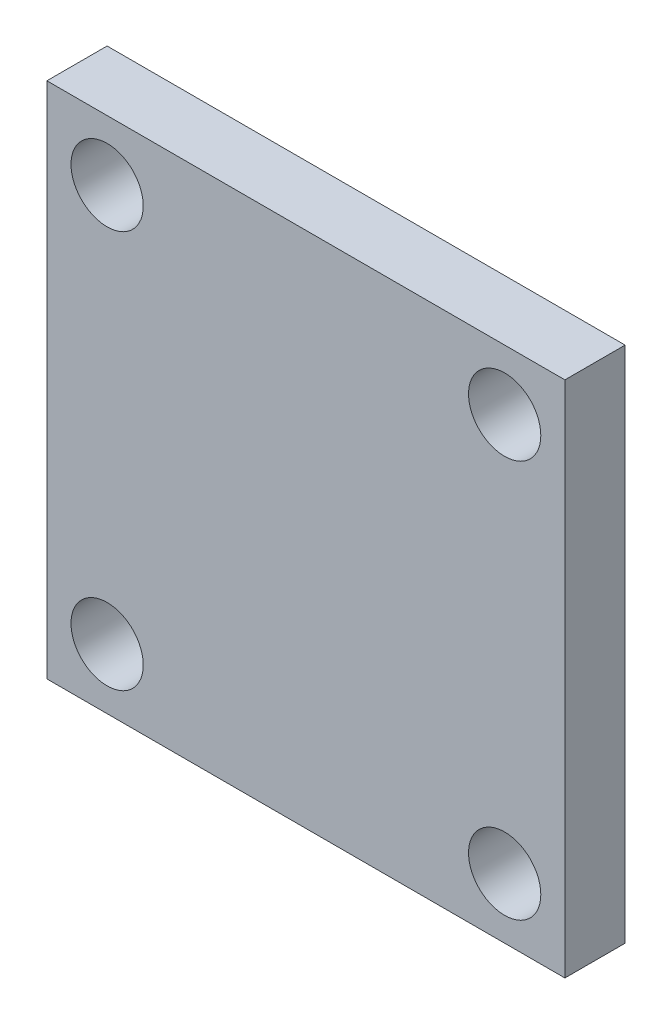
from build123d import *

# Parameters (mm, degrees)
SKETCH_1_W      = 43
SKETCH_1_H      = 43
SKETCH_1_R      = 3
EXTRUDE_1_DEPTH = 5


with BuildPart() as part:
    # 草图1 → 凸台-拉伸1 (new body)
    with BuildSketch(Plane.XY):
        Rectangle(SKETCH_1_W, SKETCH_1_H)
        with Locations((-16.5, -16.5)):
            Circle(SKETCH_1_R, mode=Mode.SUBTRACT)
        with Locations((-16.5, 16.5)):
            Circle(SKETCH_1_R, mode=Mode.SUBTRACT)
        with Locations((16.5, 16.5)):
            Circle(SKETCH_1_R, mode=Mode.SUBTRACT)
        with Locations((16.5, -16.5)):
            Circle(SKETCH_1_R, mode=Mode.SUBTRACT)
    extrude(amount=EXTRUDE_1_DEPTH)


solid = part.part
